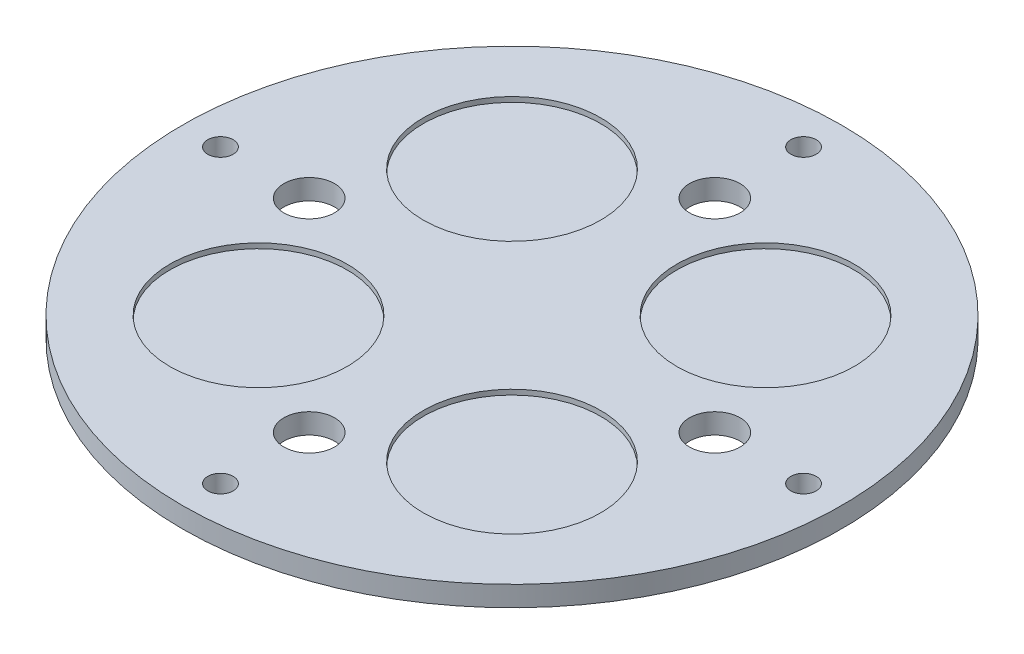
from build123d import *

# Parameters (mm, degrees)
SKETCH1_R           = 65
SKETCH1_R_2         = 17.5
BOSS_EXTRUDE2_DEPTH = 1
BOSS_EXTRUDE3_START = 3
SKETCH2_R           = 65
BOSS_EXTRUDE3_DEPTH = 3
SKETCH3_R           = 5
CUT_EXTRUDE1_DEPTH  = 128.342059038
SKETCH4_R           = 2.5
CUT_EXTRUDE2_DEPTH  = 128.342059038


with BuildPart() as part:
    # Sketch1 → Boss-Extrude2 (new body)
    with BuildSketch(Plane(origin=(0, 0, 0), x_dir=(1, 0, 0), z_dir=(0, 1, 0))):
        with Locations(Location((25, -25, 0), (0, 0, 270))):
            Circle(SKETCH1_R)
        with Locations(Location((0, 0, 0), (0, 0, 270))):
            Circle(SKETCH1_R_2, mode=Mode.SUBTRACT)
        with Locations(Location((50, 0, 0), (0, 0, 270))):
            Circle(SKETCH1_R_2, mode=Mode.SUBTRACT)
        with Locations(Location((50, -50, 0), (0, 0, 270))):
            Circle(SKETCH1_R_2, mode=Mode.SUBTRACT)
        with Locations(Location((0, -50, 0), (0, 0, 270))):
            Circle(SKETCH1_R_2, mode=Mode.SUBTRACT)
    extrude(amount=BOSS_EXTRUDE2_DEPTH)

    # Sketch2 → Boss-Extrude3 (add)
    with BuildSketch(Plane.XZ.offset(BOSS_EXTRUDE3_START)):
        with Locations(Location((25, 25, 0), (0, 0, 270))):
            Circle(SKETCH2_R)
    extrude(amount=-BOSS_EXTRUDE3_DEPTH)

    # Sketch3 → Cut-Extrude1 (cut, through all)
    with BuildSketch(Plane(origin=(0, 1, 0), x_dir=(1, 0, 0), z_dir=(0, 1, 0))):
        with Locations(Location((25, 15, 0), (0, 0, 270))):
            Circle(SKETCH3_R)
        with Locations(Location((65, -25, 0), (0, 0, 270))):
            Circle(SKETCH3_R)
        with Locations(Location((25, -65, 0), (0, 0, 270))):
            Circle(SKETCH3_R)
        with Locations(Location((-15, -25, 0), (0, 0, 270))):
            Circle(SKETCH3_R)
    extrude(amount=-CUT_EXTRUDE1_DEPTH, mode=Mode.SUBTRACT)

    # Sketch4 → Cut-Extrude2 (cut, through all)
    with BuildSketch(Plane(origin=(0, 1, 0), x_dir=(1, 0, 0), z_dir=(0, 1, 0))):
        with Locations(Location((25, 32.5, 0), (0, 0, 270))):
            Circle(SKETCH4_R)
        with Locations(Location((82.5, -25, 0), (0, 0, 270))):
            Circle(SKETCH4_R)
        with Locations(Location((25, -82.5, 0), (0, 0, 270))):
            Circle(SKETCH4_R)
        with Locations(Location((-32.5, -25, 0), (0, 0, 270))):
            Circle(SKETCH4_R)
    extrude(amount=-CUT_EXTRUDE2_DEPTH, mode=Mode.SUBTRACT)


solid = part.part
